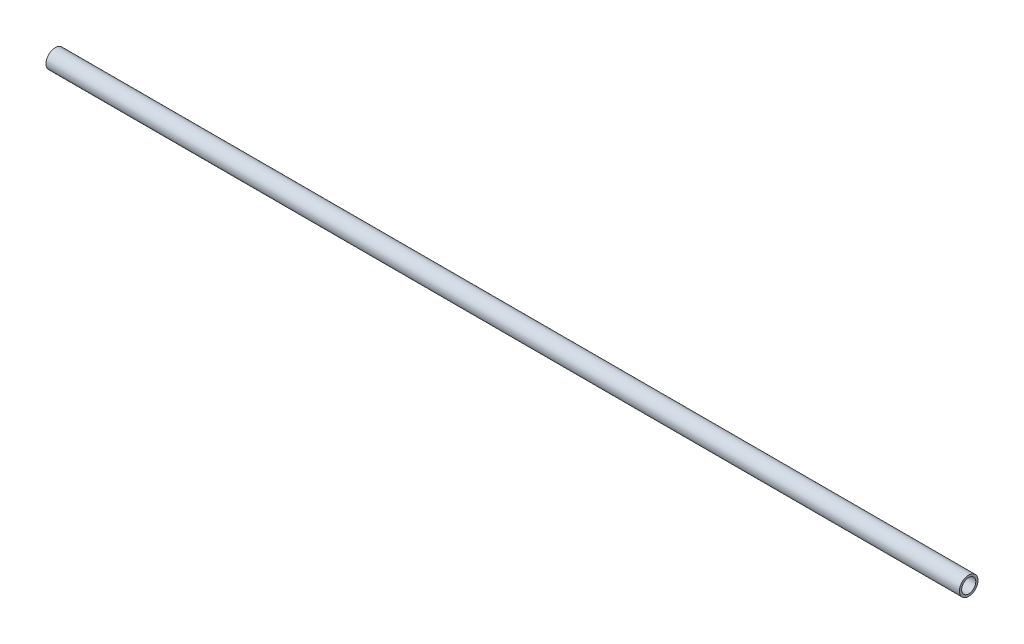
from build123d import *

# Parameters (mm, degrees)
SKETCH1_R           = 12.7
SKETCH1_R_2         = 9.652
BOSS_EXTRUDE1_DEPTH = 1250


with BuildPart() as part:
    # Sketch1 → Boss-Extrude1 (new body)
    with BuildSketch(Plane(origin=(0, 0, 0), x_dir=(0, 0, -1), z_dir=(1, 0, 0))):
        Circle(SKETCH1_R)
        Circle(SKETCH1_R_2, mode=Mode.SUBTRACT)
    extrude(amount=BOSS_EXTRUDE1_DEPTH)


solid = part.part
